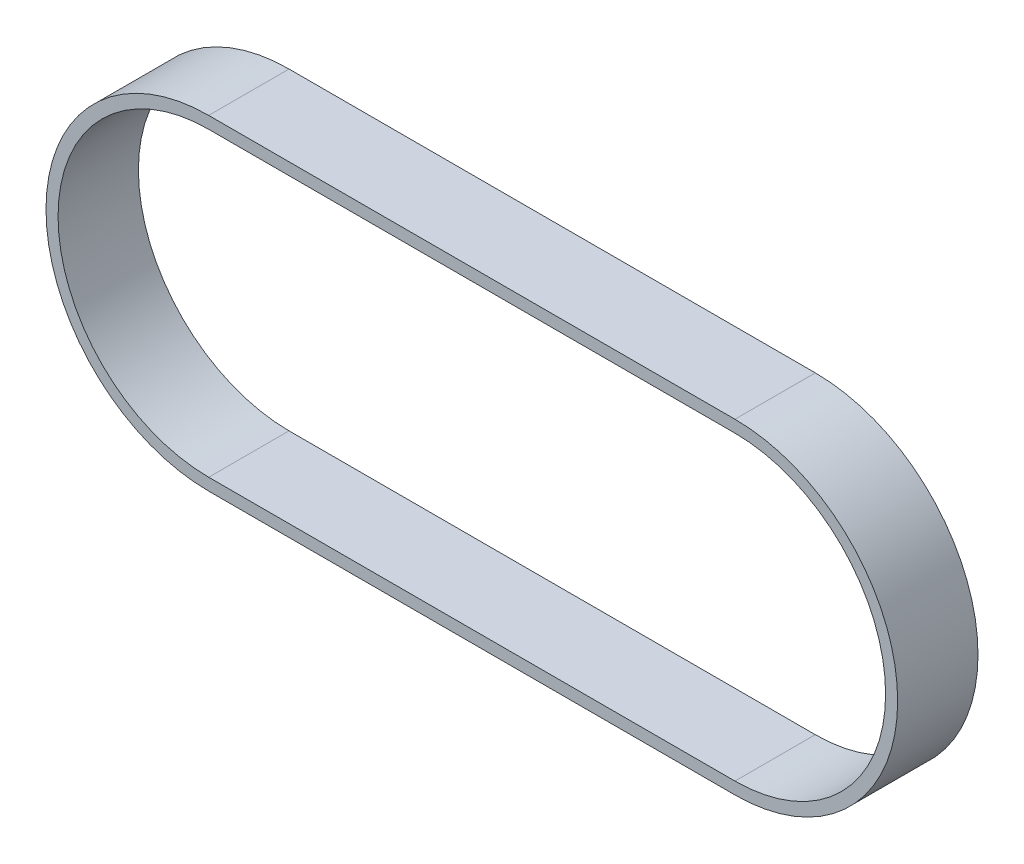
from build123d import *

# Parameters (mm, degrees)
EXTRUDE_1_DEPTH = 20


with BuildPart() as part:
    # 草图1 → 拉伸-薄壁1 (new body)
    with BuildSketch(Plane.XY):
        with BuildLine():
            Line((131, -40.5), (0, -40.5))
            ThreePointArc((0, -40.5), (-40.5, 0), (0, 40.5))
            Line((0, 40.5), (131, 40.5))
            ThreePointArc((131, 40.5), (171.5, 0), (131, -40.5))
        make_face()
        with BuildLine():
            Line((131, -37.5), (0, -37.5))
            ThreePointArc((0, -37.5), (-37.5, 0), (0, 37.5))
            Line((0, 37.5), (131, 37.5))
            ThreePointArc((131, 37.5), (168.5, 0), (131, -37.5))
        make_face(mode=Mode.SUBTRACT)
    extrude(amount=EXTRUDE_1_DEPTH)


solid = part.part
